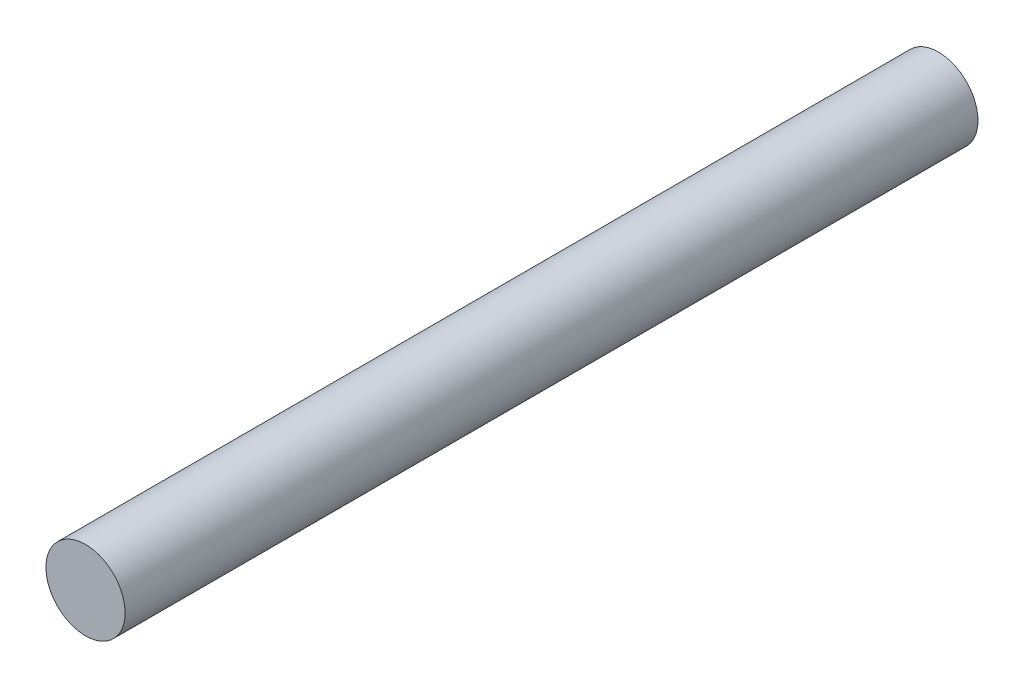
from build123d import *

# Parameters (mm, degrees)
SKETCH1_R           = 3.25
BOSS_EXTRUDE1_DEPTH = 70


with BuildPart() as part:
    # Sketch1 → Boss-Extrude1 (new body)
    with BuildSketch(Plane.XY):
        Circle(SKETCH1_R)
    extrude(amount=BOSS_EXTRUDE1_DEPTH)


solid = part.part
